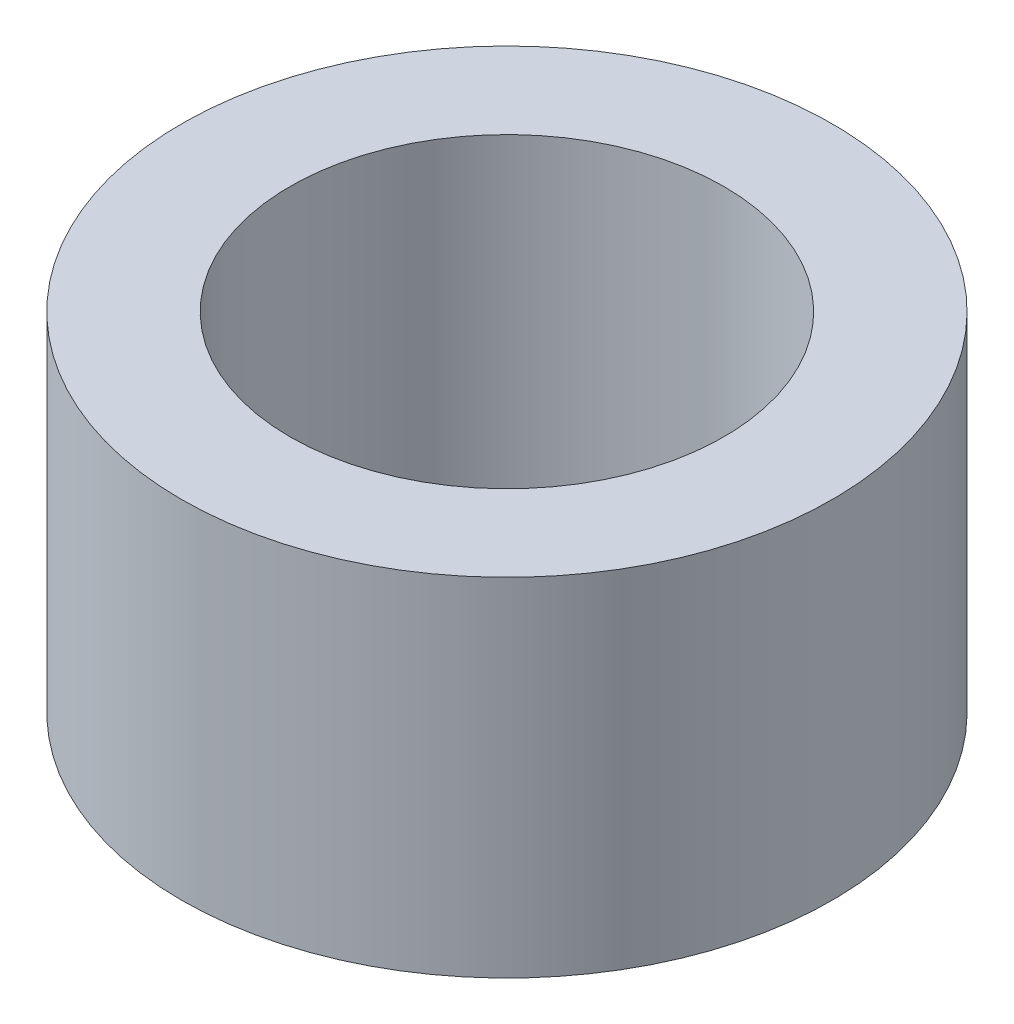
from build123d import *

# Parameters (mm, degrees)
SKETCH_1_R      = 4.5
SKETCH_1_R_2    = 3
EXTRUDE_1_DEPTH = 4.8


with BuildPart() as part:
    # ｽｹｯﾁ1 → ﾎﾞｽ - 押し出し1 (new body)
    with BuildSketch(Plane(origin=(0, 0, 0), x_dir=(1, 0, 0), z_dir=(0, 1, 0))):
        with Locations(Location((0, 0, 0), (0, 0, 270))):
            Circle(SKETCH_1_R)
        with Locations(Location((0, 0, 0), (0, 0, 270))):
            Circle(SKETCH_1_R_2, mode=Mode.SUBTRACT)
    extrude(amount=EXTRUDE_1_DEPTH)


solid = part.part
